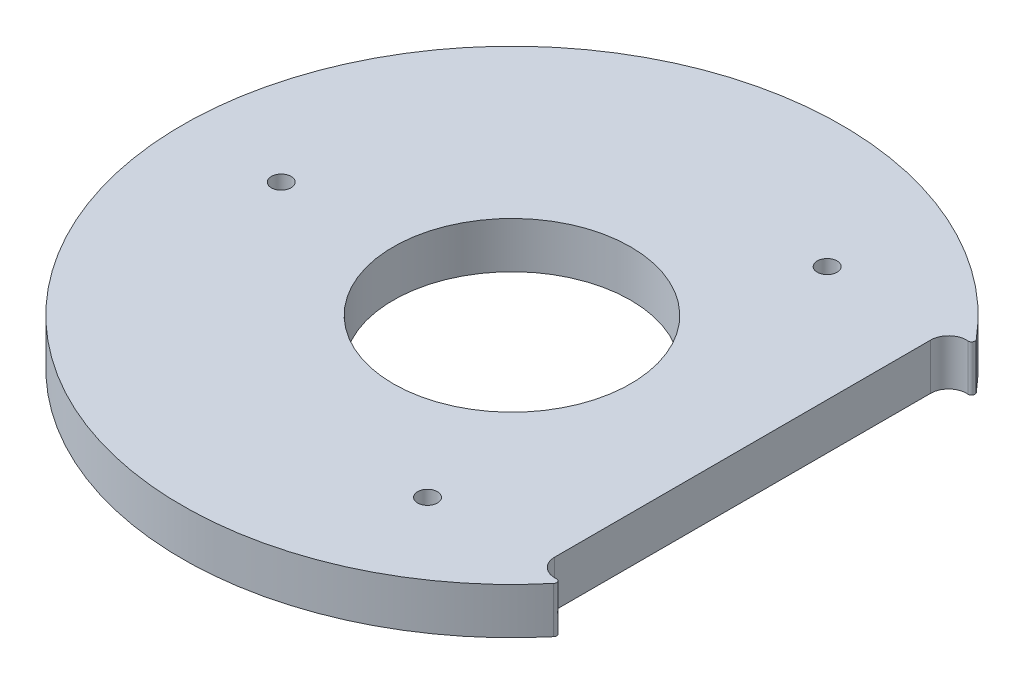
from build123d import *
from build123d.topology import SkipClean

# Parameters (mm, degrees)
SALIENTE_EXTRUIR1_DEPTH = 3.5
CROQUIS2_R              = 1.5
CORTAR_EXTRUIR1_DEPTH   = 7
CROQUIS3_R              = 4
CROQUIS3_R_2            = 3
SALIENTE_EXTRUIR2_DEPTH = 5


with BuildPart() as part:
    # Croquis1 → Saliente-Extruir1 (new, symmetric)
    with SkipClean():  # the faces are left unmerged after this step: merging them gives an invalid solid
        with BuildSketch(Plane(origin=(0, 0, 0), x_dir=(1, 0, 0), z_dir=(0, 1, 0))):
            with BuildLine():
                Line((35, 0), (18, 0))
                ThreePointArc((18, 0), (0, -18), (-18, 0))
                Line((-18, 0), (-50, 0))
                ThreePointArc((-50, 0), (-17.044661679, -47.005100875), (38.37918033, -32.047441664))
                ThreePointArc((38.37918033, -32.047441664), (38.439227262, -31.49182987), (37.949409202, -31.222779006))
                ThreePointArc((37.949409202, -31.222779006), (35.879823326, -30.517678888), (35, -28.516113802))
                Line((35, -28.516113802), (35, 0))
            make_face()
            with BuildLine():
                ThreePointArc((-18, 0), (0, 18), (18, 0))
                Line((18, 0), (35, 0))
                Line((35, 0), (35, 28.516113802))
                ThreePointArc((35, 28.516113802), (35.879823326, 30.517678888), (37.949409202, 31.222779006))
                ThreePointArc((37.949409202, 31.222779006), (38.439227262, 31.49182987), (38.37918033, 32.047441664))
                ThreePointArc((38.37918033, 32.047441664), (36.735192641, 33.919398898), (35, 35.707142143))
                ThreePointArc((35, 35.707142143), (-19.364916731, 46.097722286), (-50, 0))
                Line((-50, 0), (-18, 0))
            make_face()
        extrude(amount=SALIENTE_EXTRUIR1_DEPTH, both=True)

    # Croquis2 → Cortar-Extruir1 (cut)
    with SkipClean():  # the faces are left unmerged after this step: merging them gives an invalid solid
        with BuildSketch(Plane.XZ.offset(3.5)):
            with Locations(Location((17.5, 30.310889132, 0), (0, 0, 270))):
                Circle(CROQUIS2_R)
            with Locations(Location((-35, 0, 0), (0, 0, 270))):
                Circle(CROQUIS2_R)
            with Locations(Location((17.5, -30.310889132, 0), (0, 0, 270))):
                Circle(CROQUIS2_R)
        extrude(amount=-CORTAR_EXTRUIR1_DEPTH, mode=Mode.SUBTRACT)

    # Croquis3 → Saliente-Extruir2 (add)
    # profile 1 of 3: a face of its own
    with SkipClean():  # the faces are left unmerged after this step: merging them gives an invalid solid
        with BuildSketch(Plane.XZ.offset(3.5)):
            with Locations(Location((-35, 0, 0), (0, 0, 90))):
                Circle(CROQUIS3_R)
            with Locations(Location((-35, 0, 0), (0, 0, 270))):
                Circle(CROQUIS3_R_2, mode=Mode.SUBTRACT)
        # profile 2 of 3: a face of its own
        with BuildSketch(Plane.XZ.offset(3.5)):
            with Locations(Location((17.5, 30.310889132, 0), (0, 0, 90))):
                Circle(CROQUIS3_R)
            with Locations(Location((17.5, 30.310889132, 0), (0, 0, 270))):
                Circle(CROQUIS3_R_2, mode=Mode.SUBTRACT)
        # profile 3 of 3: a face of its own
        with BuildSketch(Plane.XZ.offset(3.5)):
            with Locations(Location((17.5, -30.310889132, 0), (0, 0, 90))):
                Circle(CROQUIS3_R)
            with Locations(Location((17.5, -30.310889132, 0), (0, 0, 270))):
                Circle(CROQUIS3_R_2, mode=Mode.SUBTRACT)
        extrude(amount=SALIENTE_EXTRUIR2_DEPTH)


solid = part.part
